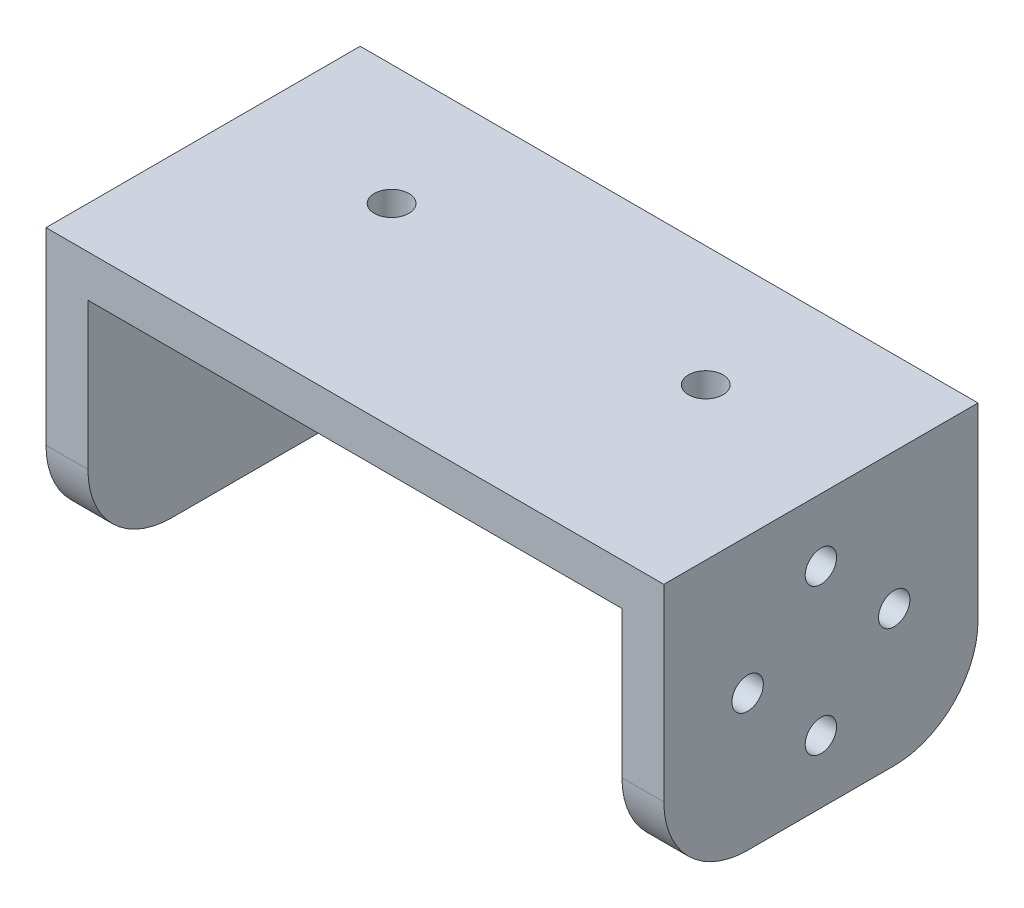
from build123d import *

# Parameters (mm, degrees)
EXTRUDE_1_DEPTH     = 30
FILLET_1_R          = 8
SKETCH_4_R          = 1.65
CUT_EXTRUDE_1_DEPTH = 10
SKETCH_5_R          = 1.65
CUT_EXTRUDE_2_DEPTH = 10
SKETCH_6_R          = 1.5
CUT_EXTRUDE_3_DEPTH = 10


with BuildPart() as part:
    # 草图1 → 凸台-拉伸1 (new body)
    with BuildSketch(Plane.XY):
        Polygon((0, 0), (29.5, 0), (29.5, -26), (25.5, -26), (25.5, -4), (0, -4), (-25.5, -4), (-25.5, -26), (-29.5, -26), (-29.5, 0), align=None)
    extrude(amount=EXTRUDE_1_DEPTH)

    # 圆角1
    fillet_1_edges = [part.edges().sort_by_distance(p)[0] for p in [
        (27.5, -26, 0),
        (-27.5, -26, 0),
        (-27.5, -26, 30),
        (27.5, -26, 30),
    ]]
    fillet(fillet_1_edges, radius=FILLET_1_R)

    # 草图4 → 切除-拉伸1 (cut)
    with BuildSketch(Plane(origin=(0, 0, 0), x_dir=(1, 0, 0), z_dir=(0, 1, 0))):
        with Locations(Location((15, -11.5, 0), (0, 0, 180))):
            Circle(SKETCH_4_R)
        with Locations(Location((-15, -11.5, 0), (0, 0, 180))):
            Circle(SKETCH_4_R)
    extrude(amount=-CUT_EXTRUDE_1_DEPTH, mode=Mode.SUBTRACT)

    # 草图5 → 切除-拉伸2 (cut)
    with BuildSketch(Plane.ZY.offset(29.5)):
        with Locations(Location((15, -13, 0), (0, 0, 270))):
            Circle(SKETCH_5_R)
    extrude(amount=-CUT_EXTRUDE_2_DEPTH, mode=Mode.SUBTRACT)

    # 草图6 → 切除-拉伸3 (cut)
    with BuildSketch(Plane(origin=(29.5, 0, 0), x_dir=(0, 0, -1), z_dir=(1, 0, 0))):
        with Locations((-15, -6)):
            Circle(SKETCH_6_R)
        with Locations((-8, -13)):
            Circle(SKETCH_6_R)
        with Locations((-15, -20)):
            Circle(SKETCH_6_R)
        with Locations((-22, -13)):
            Circle(SKETCH_6_R)
    extrude(amount=-CUT_EXTRUDE_3_DEPTH, mode=Mode.SUBTRACT)


solid = part.part
